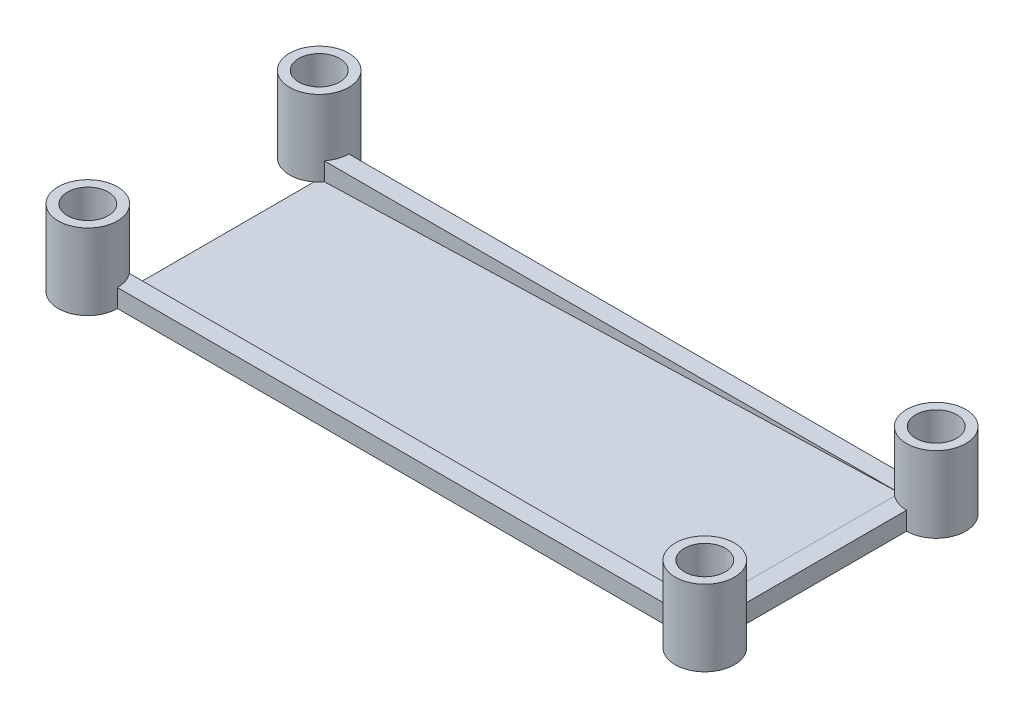
from build123d import *

# Parameters (mm, degrees)
SKETCH1_W                                    = 406.4
SKETCH1_H                                    = 152.4
BOSS_EXTRUDE1_DEPTH                          = 12
CUT_EXTRUDE1_DEPTH                           = 12
BOSS_EXTRUDE2_REACH                          = 249.278
SKETCH4_R                                    = 19.49375
SKETCH4_R_2                                  = 13.49375
BOSS_EXTRUDE3_DEPTH                          = 50
SKETCH4_2_R                                  = 13.49375
CUT_EXTRUDE2_DEPTH                           = 50
SKETCH4_3_R                                  = 13.49375
BOSS_EXTRUDE4_DEPTH                          = 12
MIRROR1_AT_THE_SECOND_PLANE_COPY_1_SKETC_R   = 19.49375
MIRROR1_AT_THE_SECOND_PLANE_COPY_1_SKETC_R_2 = 13.49375
MIRROR1_AT_THE_SECOND_PLANE_COPY_1_DEPTH     = 50
MIRROR1_AT_THE_SECOND_PLANE_COPY_2_SKETC_R   = 13.49375
MIRROR1_AT_THE_SECOND_PLANE_COPY_2_DEPTH     = 50
MIRROR1_AT_THE_SECOND_PLANE_COPY_3_SKETC_R   = 13.49375
MIRROR1_AT_THE_SECOND_PLANE_COPY_3_DEPTH     = 12


with BuildPart() as part:
    # Sketch1 → Boss-Extrude1 (new body)
    with BuildSketch(Plane(origin=(0, 0, 0), x_dir=(1, 0, 0), z_dir=(0, 1, 0))):
        Rectangle(SKETCH1_W, SKETCH1_H)
    extrude(amount=BOSS_EXTRUDE1_DEPTH)

    # Sketch2 → Cut-Extrude1 (cut)
    with BuildSketch(Plane(origin=(0, 12, 0), x_dir=(1, 0, 0), z_dir=(0, 1, 0))):
        Polygon((-203.2, -64.2), (-191.2, -64.2), (191.2, -64.2), (191.2, 64.2), (-191.2, 64.2), (-203.2, 64.2), align=None)
    extrude(amount=-CUT_EXTRUDE1_DEPTH, mode=Mode.SUBTRACT)

    # Sketch3 → Boss-Extrude2 (add, up to next)
    with BuildSketch(Plane.XY.offset(-64.2), mode=Mode.PRIVATE) as boss_extrude2_sk1:
        Polygon((-191.2, 0), (191.2, 12), (191.2, 0), align=None)
    boss_extrude2_tool1 = extrude(boss_extrude2_sk1.sketch, amount=BOSS_EXTRUDE2_REACH, mode=Mode.PRIVATE) - part.part
    add(boss_extrude2_tool1.solids().sort_by_distance((63.733333, 4, -64.2))[0])

    # Sketch4 → Boss-Extrude3 (add)
    with BuildSketch(Plane(origin=(0, 0, 0), x_dir=(1, 0, 0), z_dir=(0, 1, 0))):
        with Locations((-203.2, -76.2)):
            Circle(SKETCH4_R)
        with Locations((-203.2, -76.2)):
            Circle(SKETCH4_R_2, mode=Mode.SUBTRACT)
    boss_extrude3 = extrude(amount=BOSS_EXTRUDE3_DEPTH)

    # Sketch4<2> → Cut-Extrude2 (cut)
    with BuildSketch(Plane(origin=(0, 0, 0), x_dir=(1, 0, 0), z_dir=(0, 1, 0))):
        with Locations((-203.2, -76.2)):
            Circle(SKETCH4_2_R)
    cut_extrude2 = extrude(amount=CUT_EXTRUDE2_DEPTH, mode=Mode.SUBTRACT)

    # Sketch4<3> → Boss-Extrude4 (add)
    with BuildSketch(Plane(origin=(0, 0, 0), x_dir=(1, 0, 0), z_dir=(0, 1, 0))):
        with Locations((-203.2, -76.2)):
            Circle(SKETCH4_3_R)
    boss_extrude4 = extrude(amount=BOSS_EXTRUDE4_DEPTH)

    # Mirror1: Boss-Extrude3, Cut-Extrude2, Boss-Extrude4 across plane
    add(boss_extrude3.mirror(Plane(origin=(0, 0, 0), x_dir=(0, 0, 1), z_dir=(1, 0, 0))))
    add(cut_extrude2.mirror(Plane(origin=(0, 0, 0), x_dir=(0, 0, 1), z_dir=(1, 0, 0))), mode=Mode.SUBTRACT)
    add(boss_extrude4.mirror(Plane(origin=(0, 0, 0), x_dir=(0, 0, 1), z_dir=(1, 0, 0))))

    # Mirror1 at the second plane: Boss-Extrude3, Cut-Extrude2, Boss-Extrude4 across plane
    add(boss_extrude3.mirror(Plane.XY))
    add(cut_extrude2.mirror(Plane.XY), mode=Mode.SUBTRACT)
    add(boss_extrude4.mirror(Plane.XY))

    # Mirror1 at the second plane copy 1 sketc → Mirror1 at the second plane copy 1 (add)
    with BuildSketch(Plane(origin=(0, 0, 0), x_dir=(-1, 0, 0), z_dir=(0, 1, 0))):
        with Locations((-203.2, -76.2)):
            Circle(MIRROR1_AT_THE_SECOND_PLANE_COPY_1_SKETC_R)
        with Locations((-203.2, -76.2)):
            Circle(MIRROR1_AT_THE_SECOND_PLANE_COPY_1_SKETC_R_2, mode=Mode.SUBTRACT)
    extrude(amount=MIRROR1_AT_THE_SECOND_PLANE_COPY_1_DEPTH)

    # Mirror1 at the second plane copy 2 sketc → Mirror1 at the second plane copy 2 (cut)
    with BuildSketch(Plane(origin=(0, 0, 0), x_dir=(-1, 0, 0), z_dir=(0, 1, 0))):
        with Locations((-203.2, -76.2)):
            Circle(MIRROR1_AT_THE_SECOND_PLANE_COPY_2_SKETC_R)
    extrude(amount=MIRROR1_AT_THE_SECOND_PLANE_COPY_2_DEPTH, mode=Mode.SUBTRACT)

    # Mirror1 at the second plane copy 3 sketc → Mirror1 at the second plane copy 3 (add)
    with BuildSketch(Plane(origin=(0, 0, 0), x_dir=(-1, 0, 0), z_dir=(0, 1, 0))):
        with Locations((-203.2, -76.2)):
            Circle(MIRROR1_AT_THE_SECOND_PLANE_COPY_3_SKETC_R)
    extrude(amount=MIRROR1_AT_THE_SECOND_PLANE_COPY_3_DEPTH)


solid = part.part
